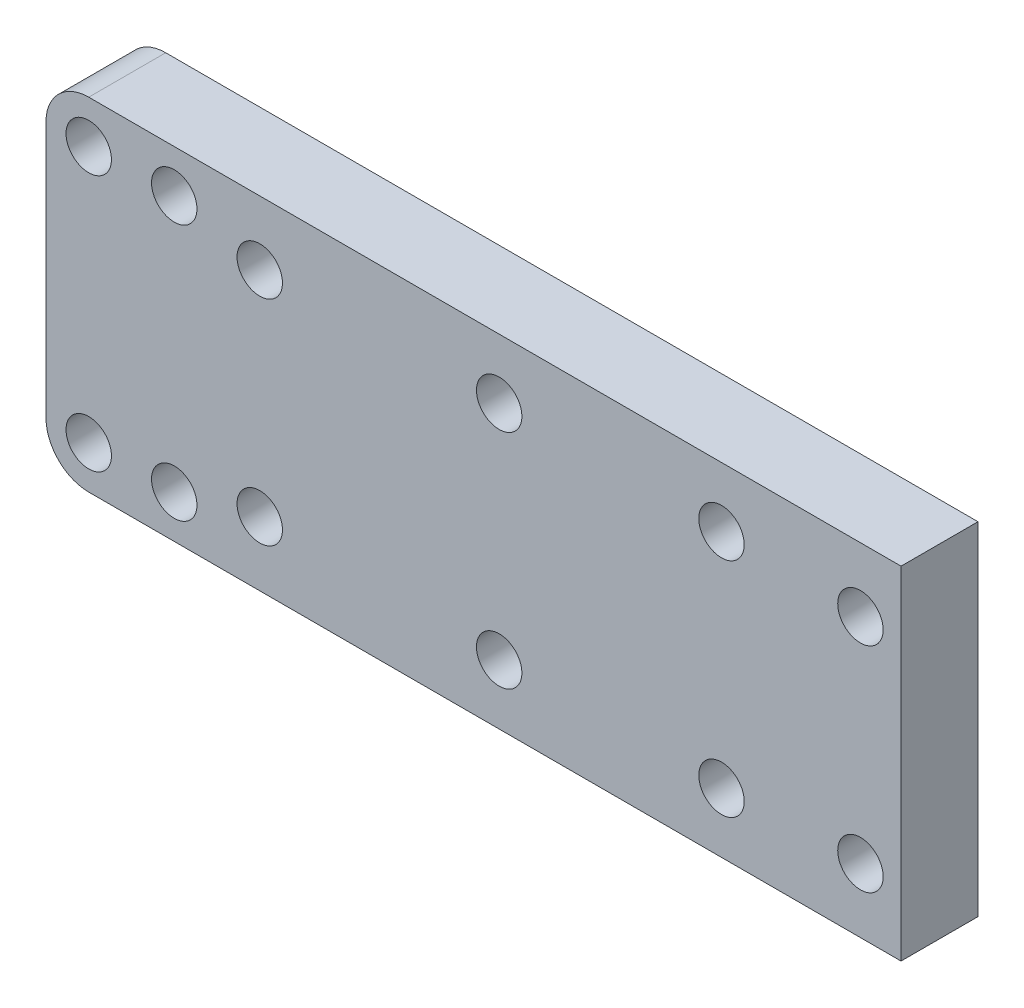
from build123d import *

# Parameters (mm, degrees)
SKETCH2_W                        = 127
SKETCH2_H                        = 50.8
BOSS_EXTRUDE1_DEPTH              = 11.43
FILLET1_R                        = 6.35
F_17_64_0_26563_DIAMETER_HOLE2_D = 6.747002
F_17_64_0_26563_DIAMETER_HOLE3_D = 6.747002
F_17_64_0_26563_DIAMETER_HOLE4_D = 6.747002
F_17_64_0_26563_DIAMETER_HOLE6_D = 6.747002


with BuildPart() as part:
    # Sketch2 → Boss-Extrude1 (new body)
    with BuildSketch(Plane.XY):
        with Locations((15.383424408, -0.971584699)):
            Rectangle(SKETCH2_W, SKETCH2_H)
    extrude(amount=BOSS_EXTRUDE1_DEPTH)

    # Fillet1
    fillet1_edges = [part.edges().sort_by_distance(p)[0] for p in [
        (-48.116575592, 24.428415301, 5.715),
        (-48.116575592, -26.371584699, 5.715),
    ]]
    fillet(fillet1_edges, radius=FILLET1_R)

    # 17/64 (0.26563) Diameter Hole2 (through all)
    with Locations(Plane(origin=(52.213424408, 15.538415301, 0), x_dir=(-1, 0, 0), z_dir=(0, 0, -1))):
        with Locations((0, 0), (33.02, 0), (33.02, -33.02), (0, -33.02)):
            Hole(F_17_64_0_26563_DIAMETER_HOLE2_D / 2)

    # 17/64 (0.26563) Diameter Hole3 (through all)
    with Locations(Plane(origin=(-16.366575592, 14.903415301, 0), x_dir=(-1, 0, 0), z_dir=(0, 0, -1))):
        with Locations((0, 0), (0, -31.75)):
            Hole(F_17_64_0_26563_DIAMETER_HOLE3_D / 2)

    # 17/64 (0.26563) Diameter Hole4 (through all)
    with Locations(Plane(origin=(72.850924408, -16.846584699, 0), x_dir=(-1, 0, 0), z_dir=(0, 0, -1))):
        with Locations((0, 0), (0, 31.75)):
            Hole(F_17_64_0_26563_DIAMETER_HOLE4_D / 2)

    # 17/64 (0.26563) Diameter Hole6 (through all)
    with Locations(Plane(origin=(-29.066575592, 18.078415301, 0), x_dir=(-1, 0, 0), z_dir=(0, 0, -1))):
        with Locations((0, 0), (12.7, 0), (12.7, -38.1), (0, -38.1)):
            Hole(F_17_64_0_26563_DIAMETER_HOLE6_D / 2)


solid = part.part
